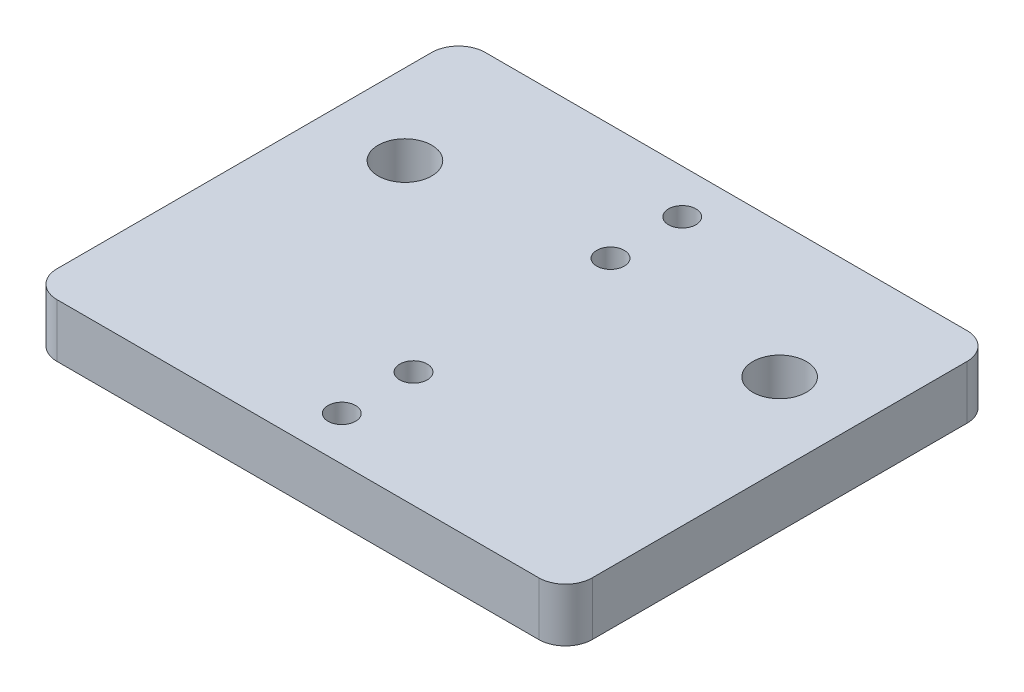
from build123d import *

# Parameters (mm, degrees)
SKETCH1_W           = 127
SKETCH1_H           = 101.6
SKETCH1_R           = 3.2639
SKETCH1_R_2         = 6.35
BOSS_EXTRUDE1_DEPTH = 6.35
FILLET1_R           = 6.35


with BuildPart() as part:
    # Sketch1 → Boss-Extrude1 (new, symmetric)
    with BuildSketch(Plane(origin=(0, 0, 0), x_dir=(1, 0, 0), z_dir=(0, 1, 0))):
        Rectangle(SKETCH1_W, SKETCH1_H)
        with Locations(Location((0, 23.368, 0), (0, 0, 270))):
            Circle(SKETCH1_R, mode=Mode.SUBTRACT)
        with Locations(Location((0, 40.386, 0), (0, 0, 270))):
            Circle(SKETCH1_R, mode=Mode.SUBTRACT)
        with Locations(Location((0, -23.368, 0), (0, 0, 90))):
            Circle(SKETCH1_R, mode=Mode.SUBTRACT)
        with Locations(Location((0, -40.386, 0), (0, 0, 90))):
            Circle(SKETCH1_R, mode=Mode.SUBTRACT)
        with Locations(Location((-44.45, 19.05, 0), (0, 0, 270))):
            Circle(SKETCH1_R_2, mode=Mode.SUBTRACT)
        with Locations(Location((44.45, 19.05, 0), (0, 0, 270))):
            Circle(SKETCH1_R_2, mode=Mode.SUBTRACT)
    extrude(amount=BOSS_EXTRUDE1_DEPTH, both=True)

    # Fillet1
    fillet1_edges = [part.edges().sort_by_distance(p)[0] for p in [
        (63.5, 0, 50.8),
        (-63.5, 0, 50.8),
        (-63.5, 0, -50.8),
        (63.5, 0, -50.8),
    ]]
    fillet(fillet1_edges, radius=FILLET1_R)


solid = part.part
